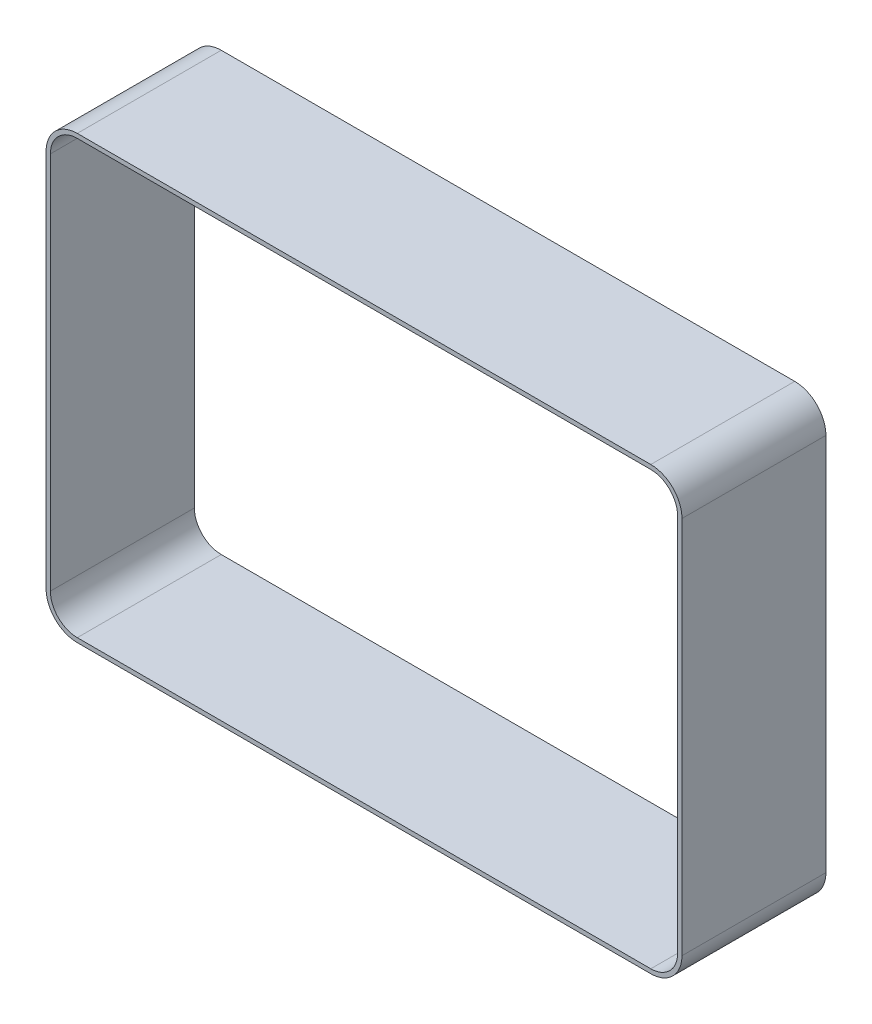
from build123d import *

# Parameters (mm, degrees)
BOSS_EXTRUDE4_DEPTH = 76.2


with BuildPart() as part:
    # Sketch1 → Boss-Extrude4 (new body)
    with BuildSketch(Plane.XY):
        with BuildLine():
            Line((-151.765, -116.713), (151.765, -116.713))
            ThreePointArc((151.765, -116.713), (163.439332957, -111.877332957), (168.275, -100.203))
            Line((168.275, -100.203), (168.275, 100.203))
            ThreePointArc((168.275, 100.203), (163.439332957, 111.877332957), (151.765, 116.713))
            Line((151.765, 116.713), (-151.765, 116.713))
            ThreePointArc((-151.765, 116.713), (-163.439332957, 111.877332957), (-168.275, 100.203))
            Line((-168.275, 100.203), (-168.275, -100.203))
            ThreePointArc((-168.275, -100.203), (-163.439332957, -111.877332957), (-151.765, -116.713))
        make_face()
        with BuildLine():
            Line((-151.765, -114.427), (151.765, -114.427))
            ThreePointArc((151.765, -114.427), (161.822886856, -110.260886856), (165.989, -100.203))
            Line((165.989, -100.203), (165.989, 100.203))
            ThreePointArc((165.989, 100.203), (161.822886856, 110.260886856), (151.765, 114.427))
            Line((151.765, 114.427), (-151.765, 114.427))
            ThreePointArc((-151.765, 114.427), (-161.822886856, 110.260886856), (-165.989, 100.203))
            Line((-165.989, 100.203), (-165.989, -100.203))
            ThreePointArc((-165.989, -100.203), (-161.822886856, -110.260886856), (-151.765, -114.427))
        make_face(mode=Mode.SUBTRACT)
    extrude(amount=BOSS_EXTRUDE4_DEPTH)


solid = part.part
